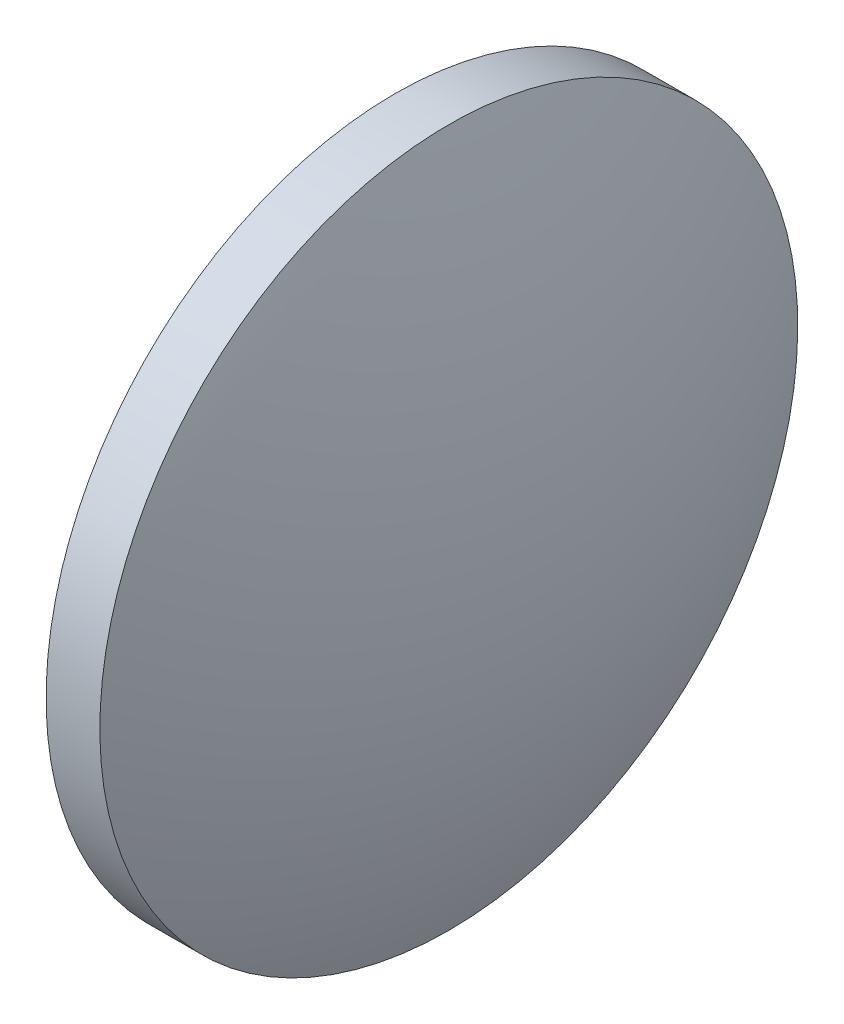
from build123d import *


with BuildPart() as part:
    # 草图1 → 旋转1 (revolve)
    with BuildSketch(Plane.XY, mode=Mode.PRIVATE) as revolve_1_sk:
        with BuildLine():
            Line((-0.828696117, 0), (0.828696117, 0))
            ThreePointArc((0.828696117, 0), (0.677842102, 1.52947121), (0.231093637, 3))
            Line((0.231093637, 3), (-0.231093637, 3))
            ThreePointArc((-0.231093637, 3), (-0.677842102, 1.52947121), (-0.828696117, 0))
        make_face()
    revolve(revolve_1_sk.sketch.rotate(Axis((-0.828696117, 0, 0), (1, 0, 0)), 180), axis=Axis((-0.828696117, 0, 0), (1, 0, 0)))


solid = part.part
